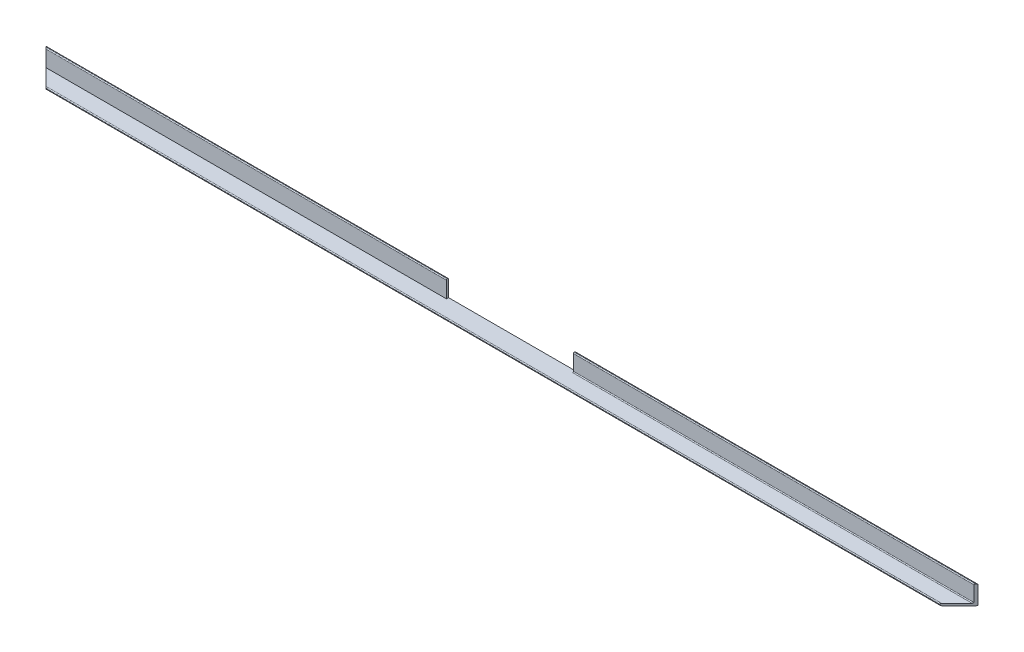
from build123d import *

# Parameters (mm, degrees)
SKETCH1_W           = 1100
SKETCH1_H           = 22.5
BOSS_EXTRUDE1_DEPTH = 2.5
SKETCH2_W           = 1100
SKETCH2_H           = 2.5
BOSS_EXTRUDE2_DEPTH = 20
SKETCH3_W           = 150
SKETCH3_H           = 20
CUT_EXTRUDE1_DEPTH  = 10
CUT_EXTRUDE2_DEPTH  = 551.57498354
FILLET1_R           = 1


with BuildPart() as part:
    # Sketch1 → Boss-Extrude1 (new body)
    with BuildSketch(Plane(origin=(0, 0, 0), x_dir=(1, 0, 0), z_dir=(0, 1, 0))):
        Rectangle(SKETCH1_W, SKETCH1_H)
    extrude(amount=BOSS_EXTRUDE1_DEPTH)

    # Sketch2 → Boss-Extrude2 (add)
    with BuildSketch(Plane(origin=(0, 2.5, 0), x_dir=(1, 0, 0), z_dir=(0, 1, 0))):
        with Locations((0, 10)):
            Rectangle(SKETCH2_W, SKETCH2_H)
    extrude(amount=BOSS_EXTRUDE2_DEPTH)

    # Sketch3 → Cut-Extrude1 (cut)
    with BuildSketch(Plane.XY.offset(-8.75)):
        with Locations((0, 12.5)):
            Rectangle(SKETCH3_W, SKETCH3_H)
    extrude(amount=-CUT_EXTRUDE1_DEPTH, mode=Mode.SUBTRACT)

    # Sketch4 → Cut-Extrude2 (cut, through all)
    with BuildSketch(Plane(origin=(0, 0, 0), x_dir=(-1, 0, 0), z_dir=(0, -1, 0))):
        Polygon((-550, 11.25), (-527.5, -11.25), (-550, -11.25), align=None)
        Polygon((550, -11.25), (550, 11.25), (527.5, -11.25), align=None)
    extrude(amount=-CUT_EXTRUDE2_DEPTH, mode=Mode.SUBTRACT)

    # Fillet1
    fillet1_edges = [part.edges().sort_by_distance(p)[0] for p in [
        (312.5, 22.5, -11.25),
        (311.25, 22.5, -8.75),
        (-312.5, 22.5, -11.25),
        (311.25, 2.5, -8.75),
        (0, 0, -11.25),
        (0, 0, 11.25),
        (0, 2.5, 11.25),
        (-311.25, 22.5, -8.75),
    ]]
    fillet(fillet1_edges, radius=FILLET1_R)


solid = part.part
